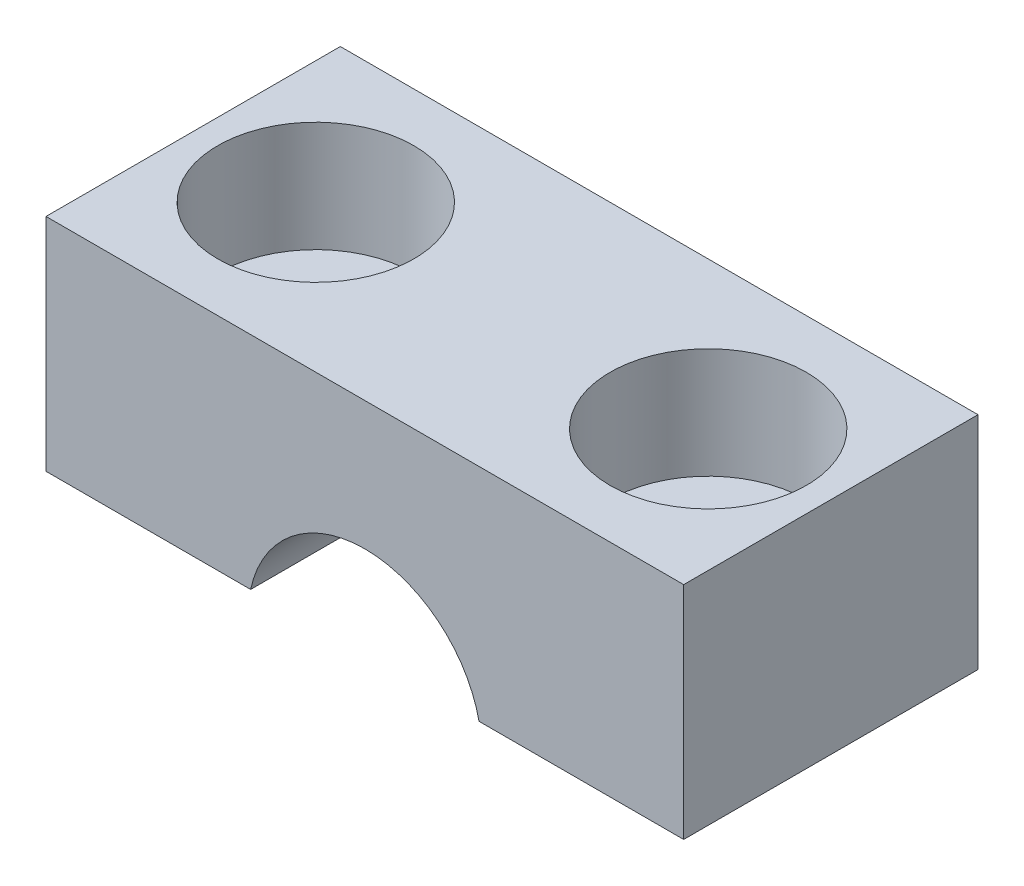
from build123d import *

# Parameters (mm, degrees)
SKETCH1_W                                        = 26
SKETCH1_H                                        = 12
BOSS_EXTRUDE1_DEPTH                              = 9
CUT_EXTRUDE1_DEPTH                               = 40.217343102
CBORE_FOR_M4_HEX_HEAD_MACHINE_SCREW1_D           = 4.5
CBORE_FOR_M4_HEX_HEAD_MACHINE_SCREW1_CBORE_D     = 8
CBORE_FOR_M4_HEX_HEAD_MACHINE_SCREW1_CBORE_DEPTH = 4.5


with BuildPart() as part:
    # Sketch1 → Boss-Extrude1 (new body)
    with BuildSketch(Plane(origin=(0, 35, 0), x_dir=(1, 0, 0), z_dir=(0, 1, 0))):
        Rectangle(SKETCH1_W, SKETCH1_H)
    extrude(amount=-BOSS_EXTRUDE1_DEPTH)

    # Sketch2 → Cut-Extrude1 (cut, through all)
    with BuildSketch(Plane(origin=(0, 0, -6), x_dir=(-1, 0, 0), z_dir=(0, 0, -1))):
        with BuildLine():
            Line((-4.656329697, 26), (4.656329697, 26))
            ThreePointArc((4.656329697, 26), (0, 29.7625), (-4.656329697, 26))
        make_face()
    extrude(amount=-CUT_EXTRUDE1_DEPTH, mode=Mode.SUBTRACT)

    # CBORE for M4 Hex Head Machine Screw1 (through all)
    with Locations(Plane(origin=(0, 35, 0), x_dir=(1, 0, 0), z_dir=(0, 1, 0))):
        with Locations((-8, 0), (8, 0)):
            CounterBoreHole(CBORE_FOR_M4_HEX_HEAD_MACHINE_SCREW1_D / 2, CBORE_FOR_M4_HEX_HEAD_MACHINE_SCREW1_CBORE_D / 2, CBORE_FOR_M4_HEX_HEAD_MACHINE_SCREW1_CBORE_DEPTH)


solid = part.part
